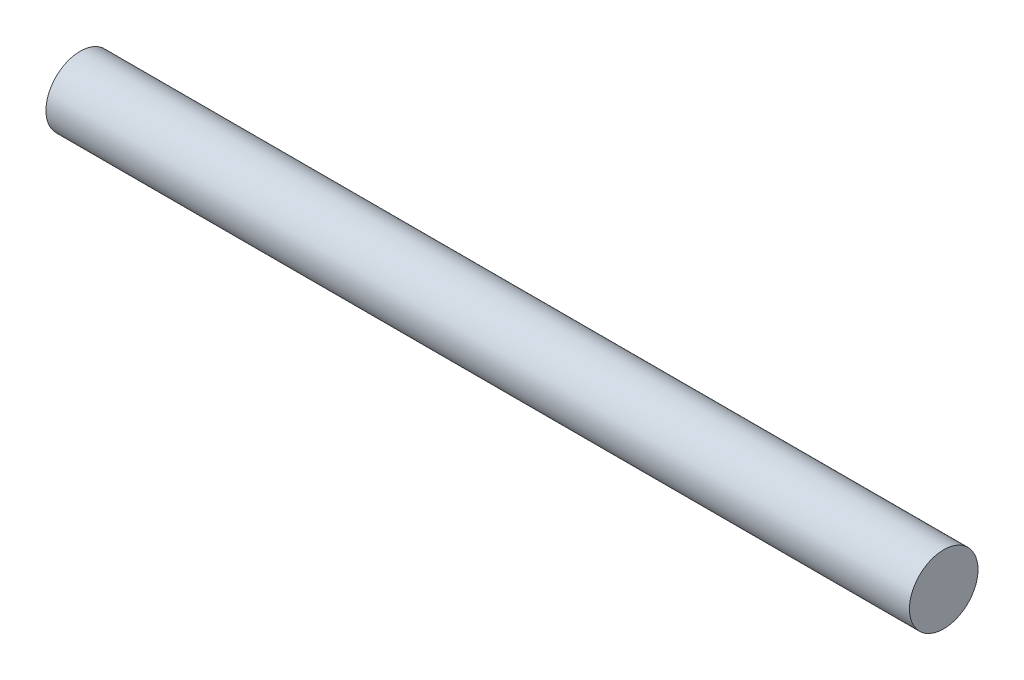
from build123d import *

# Parameters (mm, degrees)
SKETCH1_R           = 2.5
BOSS_EXTRUDE1_DEPTH = 62.95


with BuildPart() as part:
    # Sketch1 → Boss-Extrude1 (new body)
    with BuildSketch(Plane(origin=(0, 0, 0), x_dir=(0, 0, -1), z_dir=(1, 0, 0))):
        Circle(SKETCH1_R)
    extrude(amount=BOSS_EXTRUDE1_DEPTH)


solid = part.part
